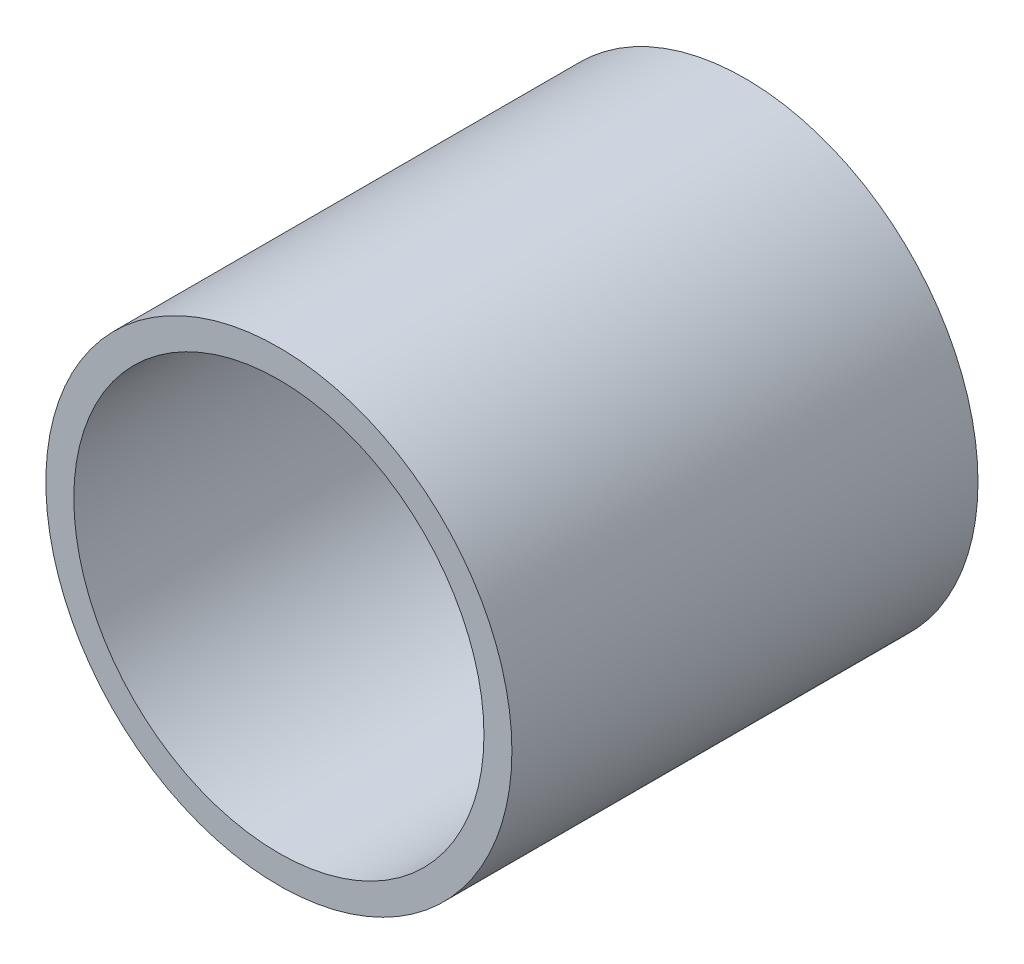
from build123d import *

# Parameters (mm, degrees)
SKETCH1_R           = 25
SKETCH1_R_2         = 22
BOSS_EXTRUDE1_DEPTH = 25


with BuildPart() as part:
    # Sketch1 → Boss-Extrude1 (new, symmetric)
    with BuildSketch(Plane.XY):
        Circle(SKETCH1_R)
        Circle(SKETCH1_R_2, mode=Mode.SUBTRACT)
    extrude(amount=BOSS_EXTRUDE1_DEPTH, both=True)


solid = part.part
